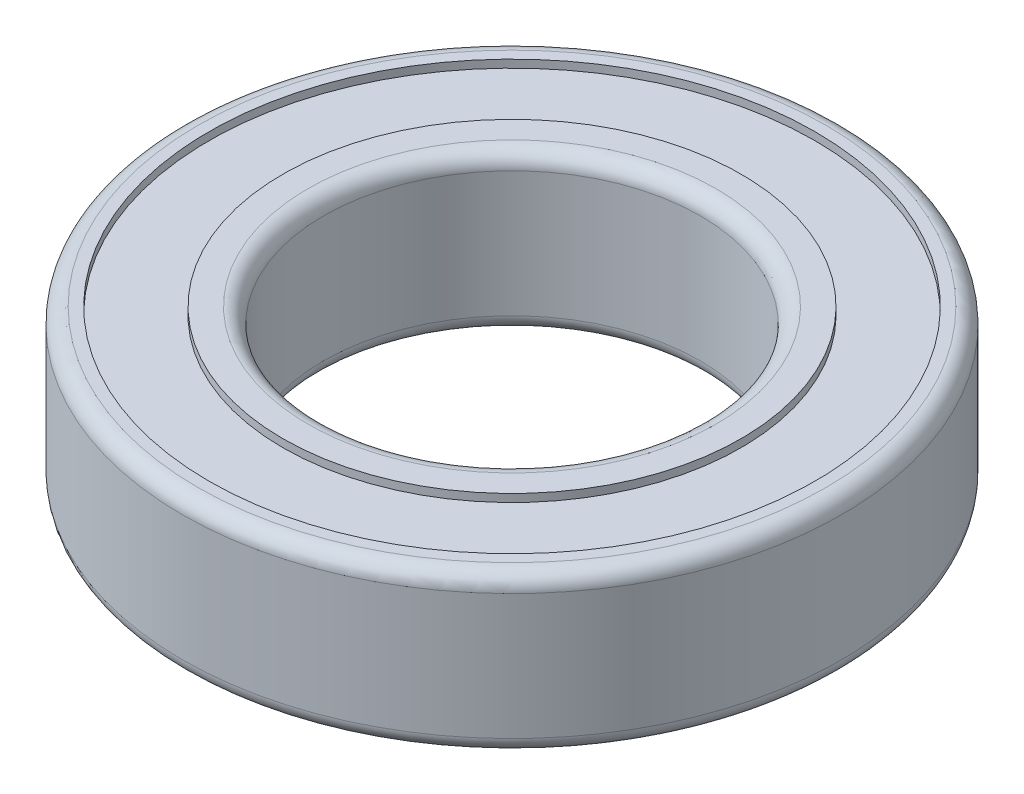
from build123d import *

# Parameters (mm, degrees)
VERRUNDUNG1_R = 0.5


with BuildPart() as part:
    # Skizze1 → Rotation1 (revolve)
    with BuildSketch(Plane.XY, mode=Mode.PRIVATE) as rotation1_sk:
        Polygon((6, 0), (7.3, 0), (7.3, 0.25), (9.65, 0.25), (9.65, 0), (10.5, 0), (10.5, 5), (9.65, 5), (9.65, 4.75), (7.3, 4.75), (7.3, 5), (6, 5), align=None)
    revolve(rotation1_sk.sketch.rotate(Axis((0, 0, 0), (0, -1, 0)), 90), axis=Axis((0, 0, 0), (0, -1, 0)))

    # Verrundung1
    verrundung1_edges = [part.edges().sort_by_distance(p)[0] for p in [
        (0, 5, -10.5),
        (0, 0, -10.5),
        (0, 0, -6),
        (0, 5, -6),
    ]]
    fillet(verrundung1_edges, radius=VERRUNDUNG1_R)


solid = part.part
